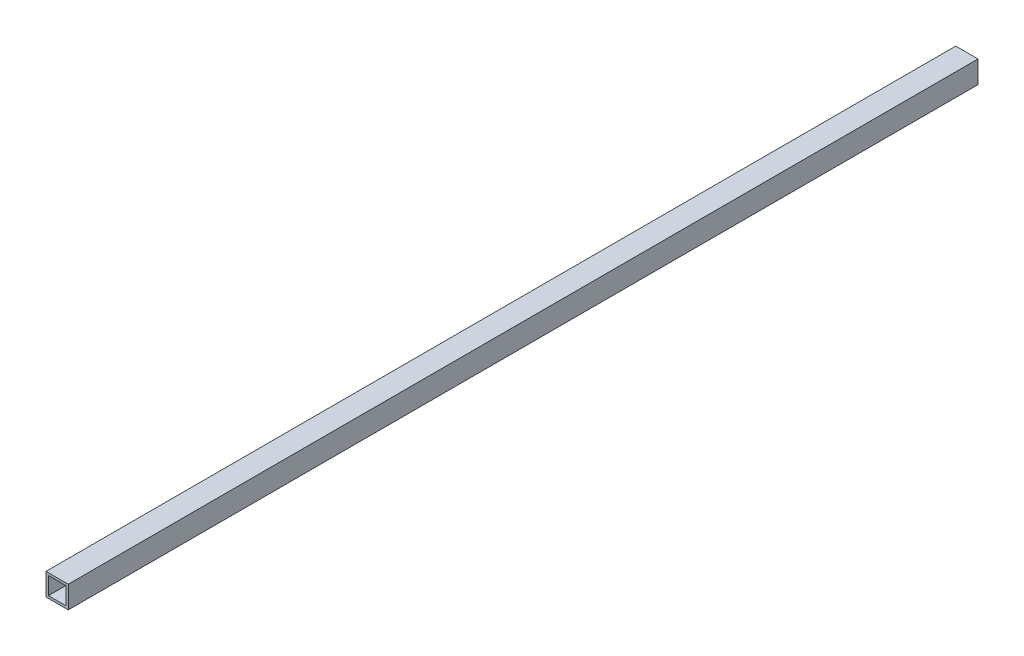
from build123d import *

# Parameters (mm, degrees)
SKETCH_1_W      = 14
SKETCH_1_H      = 14
SKETCH_1_W_2    = 11
SKETCH_1_H_2    = 11
EXTRUDE_1_DEPTH = 572


with BuildPart() as part:
    # 草图1 → 拉伸-薄壁1 (new body)
    with BuildSketch(Plane.XY):
        Rectangle(SKETCH_1_W, SKETCH_1_H)
        Rectangle(SKETCH_1_W_2, SKETCH_1_H_2, mode=Mode.SUBTRACT)
    extrude(amount=EXTRUDE_1_DEPTH)


solid = part.part
